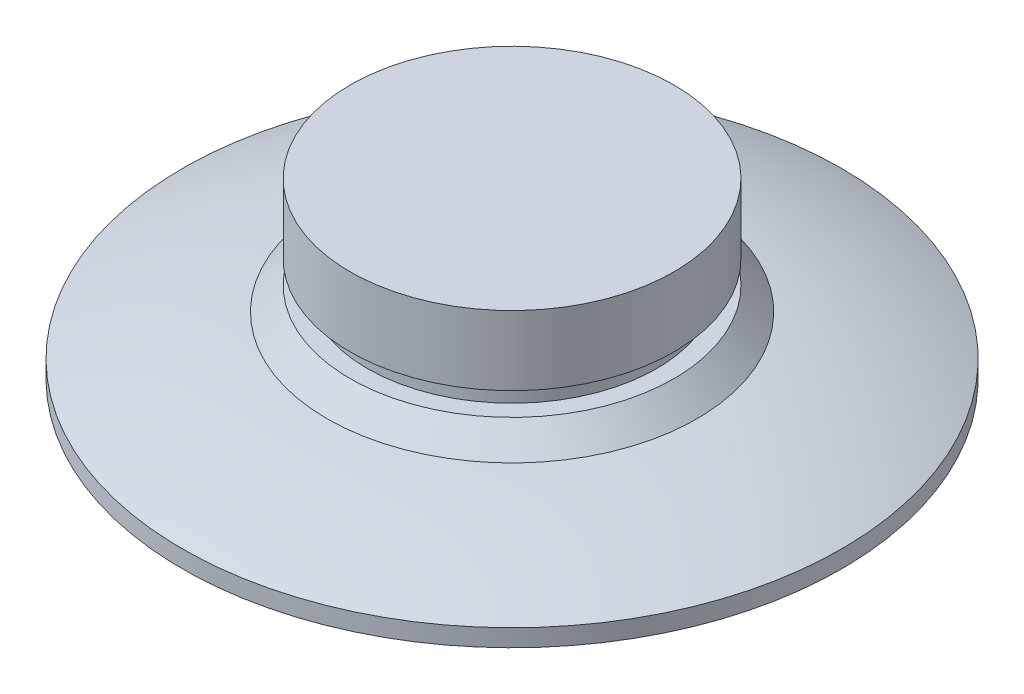
from build123d import *


with BuildPart() as part:
    # 草图2 → 旋转1 (revolve)
    with BuildSketch(Plane.XY, mode=Mode.PRIVATE) as revolve_1_sk:
        with BuildLine():
            Line((0, 0), (28.5, 0))
            Line((28.5, 0), (28.5, 1.5))
            ThreePointArc((28.5, 1.5), (22.375266099, 3.697378925), (16, 5))
            Line((16, 5), (14, 7))
            Line((14, 7), (12.5, 7))
            Line((12.5, 7), (12.5, 9))
            Line((12.5, 9), (14, 9))
            Line((14, 9), (14, 15))
            Line((14, 15), (0, 15))
            Line((0, 15), (0, 0))
        make_face()
    revolve(revolve_1_sk.sketch.rotate(Axis((0, 0, 0), (0, 1, 0)), 90), axis=Axis((0, 0, 0), (0, 1, 0)))


solid = part.part
